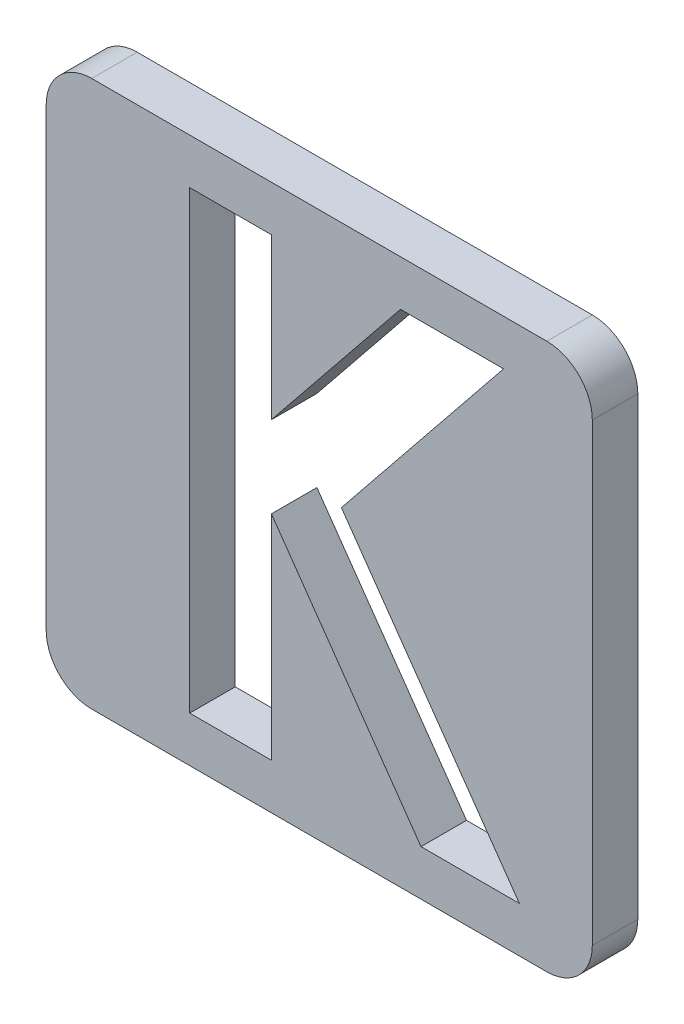
from build123d import *

# Parameters (mm, degrees)
BOSS_EXTRUDE1_DEPTH = 10
CUT_EXTRUDE24_DEPTH = 10


with BuildPart() as part:
    # Sketch1 → Boss-Extrude1 (new body)
    with BuildSketch(Plane.XY):
        with BuildLine():
            Line((-50, 60), (50, 60))
            ThreePointArc((50, 60), (57.071067812, 57.071067812), (60, 50))
            Line((60, 50), (60, -50))
            ThreePointArc((60, -50), (57.071067812, -57.071067812), (50, -60))
            Line((50, -60), (-50, -60))
            ThreePointArc((-50, -60), (-57.071067812, -57.071067812), (-60, -50))
            Line((-60, -50), (-60, 50))
            ThreePointArc((-60, 50), (-57.071067812, 57.071067812), (-50, 60))
        make_face()
    extrude(amount=BOSS_EXTRUDE1_DEPTH)

    # Sketch2 → Cut-Extrude24 (cut)
    with BuildSketch(Plane.XY.offset(10)):
        Polygon((-28.461538462, 50), (-10.512820513, 50), (-10.512820513, 14.803685897), (17.852564103, 50), (40.508814103, 50), (4.871794872, 5.769230769), (43.974358974, -50), (22.359775641, -50), (-10.512820513, -3.104967949), (-10.512820513, -50), (-28.461538462, -50), align=None)
    extrude(amount=-CUT_EXTRUDE24_DEPTH, mode=Mode.SUBTRACT)


solid = part.part
